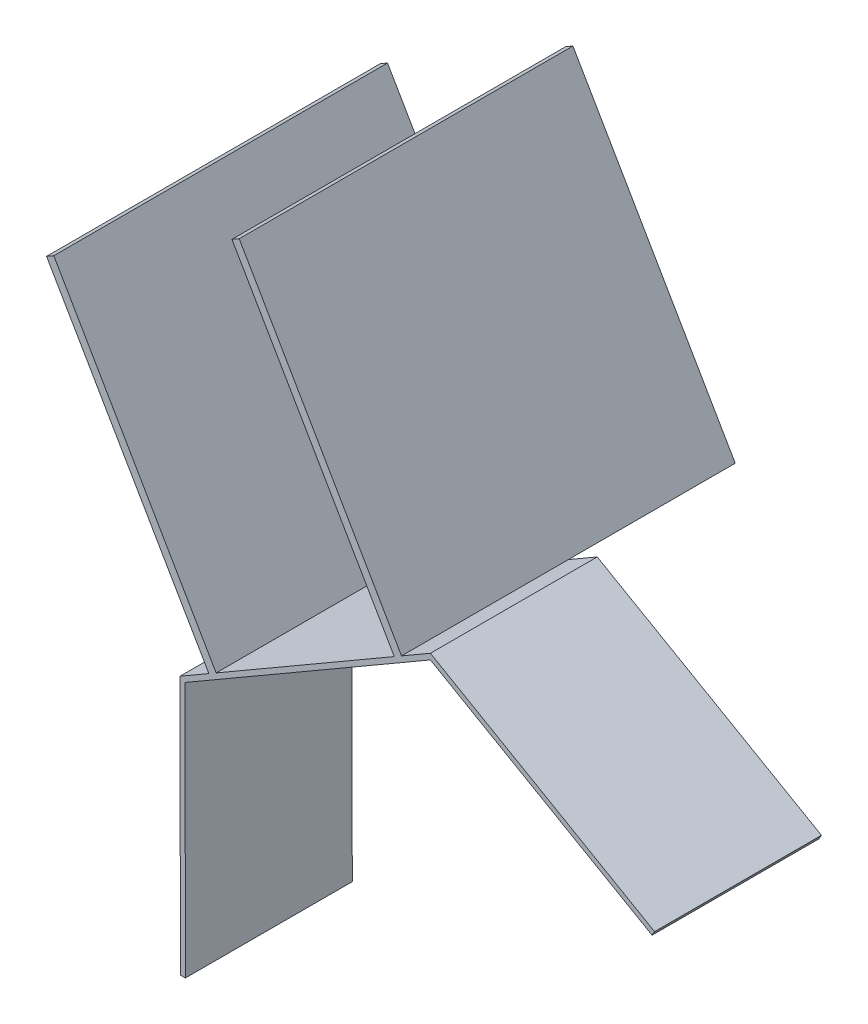
from build123d import *

# Parameters (mm, degrees)
BOSS_EXTRUDE3_DEPTH = 50
SKETCH3_W           = 5
SKETCH3_H           = 200
BOSS_EXTRUDE4_DEPTH = 194.04


with BuildPart() as part:
    # Sketch1 → Boss-Extrude3 (new, symmetric)
    with BuildSketch(Plane.XY):
        Polygon((-605.658970563, 869.326926327), (-605.421491465, 714.331361266), (-602.421487943, 714.331361266), (-602.651320044, 864.335957761), (-602.656320364, 867.599518288), (-455.616774381, 952.797835671), (-452.784185512, 951.168221277), (-322.765615027, 876.367343414), (-321.26959747, 878.967714824), (-451.288167955, 953.768592687), (-455.622120304, 956.261955282), align=None)
    extrude(amount=BOSS_EXTRUDE3_DEPTH, both=True)

    # Sketch3 → Boss-Extrude4 (add)
    with BuildSketch(Plane(origin=(-529.334093448, 913.551431111, 0), x_dir=(0.8652472150761933, 0.5013454465764019, 0), z_dir=(-0.5013454465764018, 0.8652472150761932, 0))):
        with Locations((62.691806295, 50)):
            Rectangle(SKETCH3_W, SKETCH3_H)
        with Locations((-65.711641465, 50)):
            Rectangle(SKETCH3_W, SKETCH3_H)
    extrude(amount=BOSS_EXTRUDE4_DEPTH)


solid = part.part
